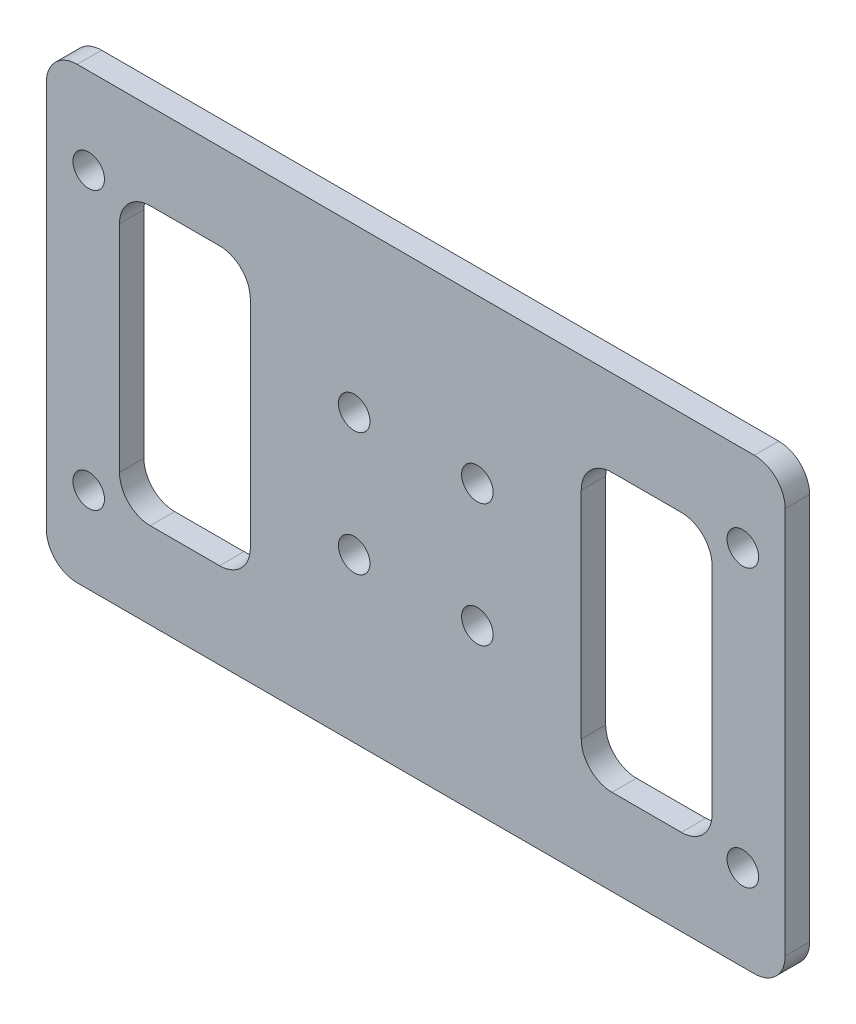
from build123d import *

# Parameters (mm, degrees)
SKETCH1_W           = 96
SKETCH1_H           = 58.35
SKETCH1_R           = 2.05
SKETCH1_W_2         = 17
SKETCH1_H_2         = 36
BOSS_EXTRUDE1_DEPTH = 3.175
FILLET1_R           = 4


with BuildPart() as part:
    # Sketch1 → Boss-Extrude1 (new body)
    with BuildSketch(Plane.XY):
        Rectangle(SKETCH1_W, SKETCH1_H)
        with Locations((-42.5, 18)):
            Circle(SKETCH1_R, mode=Mode.SUBTRACT)
        with Locations((-42.5, -18)):
            Circle(SKETCH1_R, mode=Mode.SUBTRACT)
        with Locations((42.5, 18)):
            Circle(SKETCH1_R, mode=Mode.SUBTRACT)
        with Locations((42.5, -18)):
            Circle(SKETCH1_R, mode=Mode.SUBTRACT)
        with Locations((8, -8)):
            Circle(SKETCH1_R, mode=Mode.SUBTRACT)
        with Locations((-8, -8)):
            Circle(SKETCH1_R, mode=Mode.SUBTRACT)
        with Locations((-8, 8)):
            Circle(SKETCH1_R, mode=Mode.SUBTRACT)
        with Locations((8, 8)):
            Circle(SKETCH1_R, mode=Mode.SUBTRACT)
        with Locations((-30, 0)):
            Rectangle(SKETCH1_W_2, SKETCH1_H_2, mode=Mode.SUBTRACT)
        with Locations((30, 0)):
            Rectangle(SKETCH1_W_2, SKETCH1_H_2, mode=Mode.SUBTRACT)
    extrude(amount=BOSS_EXTRUDE1_DEPTH)

    # Fillet1
    fillet1_edges = [part.edges().sort_by_distance(p)[0] for p in [
        (-21.5, 18, 1.5875),
        (-38.5, 18, 1.5875),
        (-38.5, -18, 1.5875),
        (-21.5, -18, 1.5875),
        (21.5, -18, 1.5875),
        (38.5, -18, 1.5875),
        (38.5, 18, 1.5875),
        (21.5, 18, 1.5875),
        (-48, 29.175, 1.5875),
        (48, 29.175, 1.5875),
        (48, -29.175, 1.5875),
        (-48, -29.175, 1.5875),
    ]]
    fillet(fillet1_edges, radius=FILLET1_R)


solid = part.part
